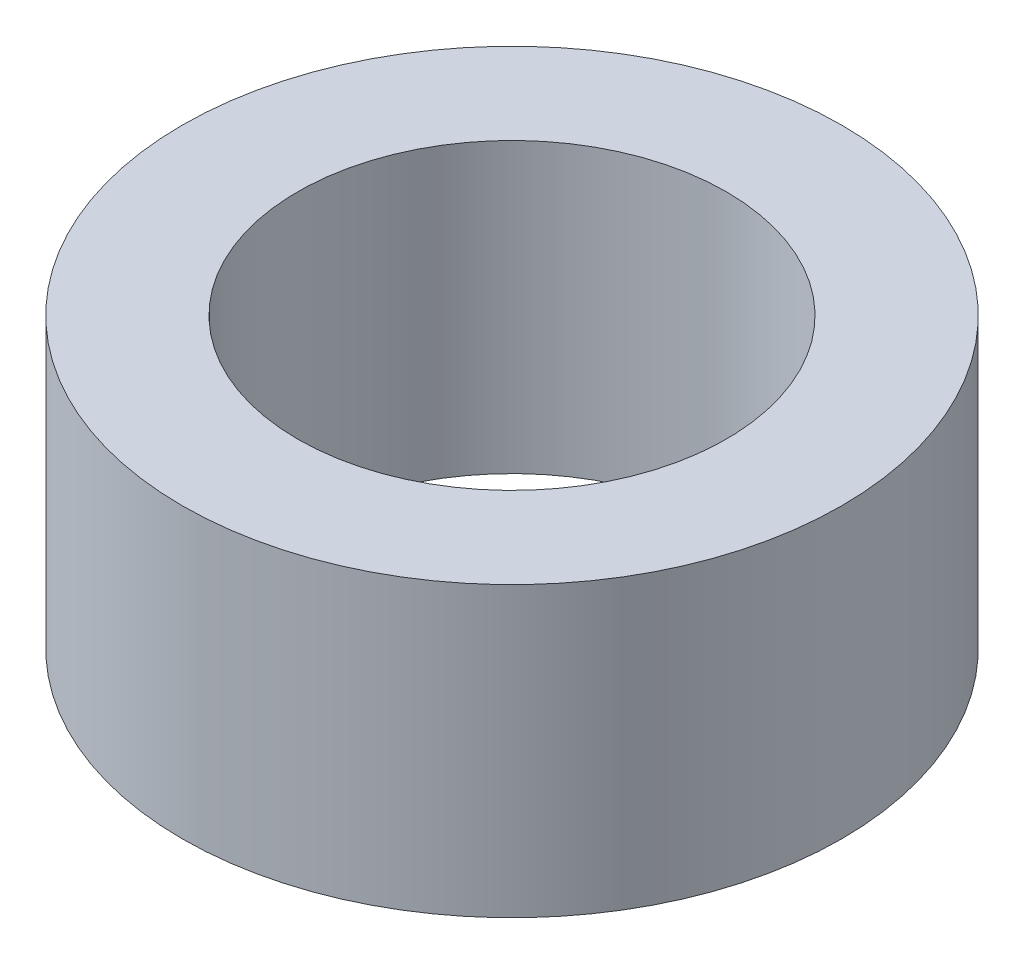
from build123d import *

# Parameters (mm, degrees)
SKETCH_1_R      = 4
SKETCH_1_R_2    = 2.6
EXTRUDE_1_DEPTH = 3.5


with BuildPart() as part:
    # ｽｹｯﾁ1 → ﾎﾞｽ - 押し出し1 (new body)
    with BuildSketch(Plane(origin=(0, 0, 0), x_dir=(1, 0, 0), z_dir=(0, 1, 0))):
        with Locations(Location((0, 0, 0), (0, 0, 270))):
            Circle(SKETCH_1_R)
        with Locations(Location((0, 0, 0), (0, 0, 270))):
            Circle(SKETCH_1_R_2, mode=Mode.SUBTRACT)
    extrude(amount=EXTRUDE_1_DEPTH)


solid = part.part
